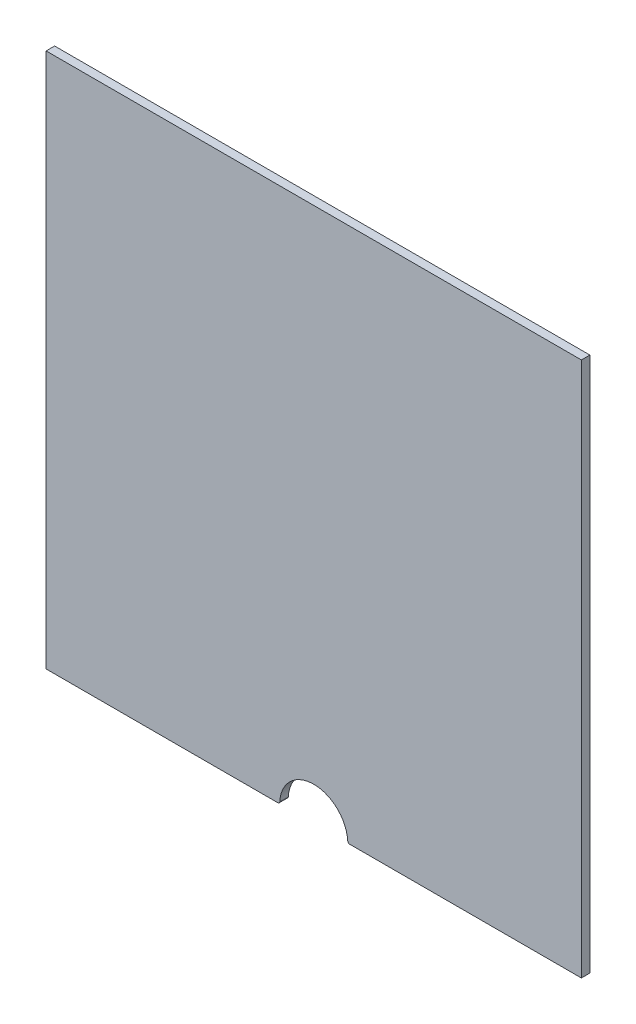
from build123d import *

# Parameters (mm, degrees)
SKETCH1_W           = 200
SKETCH1_H           = 200
BOSS_EXTRUDE1_DEPTH = 3.175
SKETCH5_W           = 200
SKETCH5_H           = 200
SKETCH5_W_2         = 199.8984
SKETCH5_H_2         = 199.8984
CUT_EXTRUDE2_DEPTH  = 283.860532109
CUT_EXTRUDE1_DEPTH  = 3.175
FILLET1_R           = 0.79375


with BuildPart() as part:
    # Sketch1 → Boss-Extrude1 (new body)
    with BuildSketch(Plane.XY):
        with Locations((100, 100)):
            Rectangle(SKETCH1_W, SKETCH1_H)
    extrude(amount=BOSS_EXTRUDE1_DEPTH)

    # Sketch5 → Cut-Extrude2 (cut, through all)
    with BuildSketch(Plane.XY.offset(3.175)):
        with Locations((100, 100)):
            Rectangle(SKETCH5_W, SKETCH5_H)
        with Locations((100, 100)):
            Rectangle(SKETCH5_W_2, SKETCH5_H_2, mode=Mode.SUBTRACT)
    extrude(amount=-CUT_EXTRUDE2_DEPTH, mode=Mode.SUBTRACT)

    # Sketch2 → Cut-Extrude1 (cut)
    with BuildSketch(Plane.XY.offset(3.175)):
        with BuildLine():
            Line((87.3, 0.0508), (112.7, 0.0508))
            ThreePointArc((112.7, 0.0508), (100, 12.7508), (87.3, 0.0508))
        make_face()
    extrude(amount=-CUT_EXTRUDE1_DEPTH, mode=Mode.SUBTRACT)

    # Fillet1
    fillet1_edges = [part.edges().sort_by_distance(p)[0] for p in [
        (87.3, 0.0508, 1.5875),
        (112.7, 0.0508, 1.5875),
    ]]
    fillet(fillet1_edges, radius=FILLET1_R)


solid = part.part
